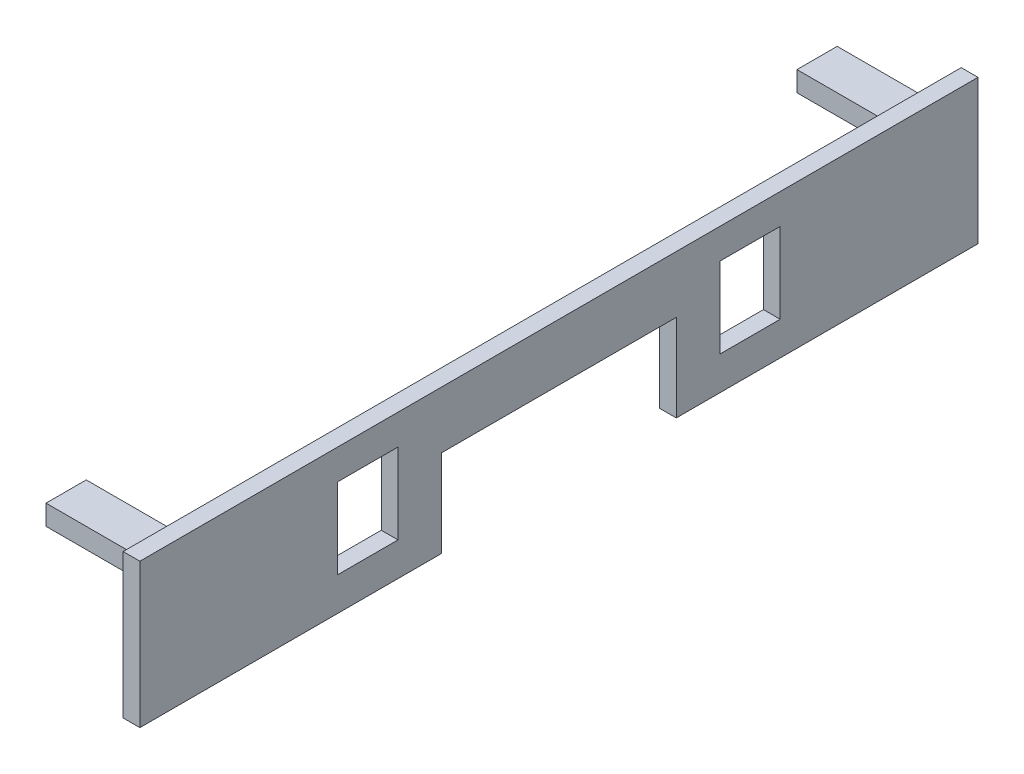
from build123d import *

# Parameters (mm, degrees)
SK_P01_BUMPERFACE_W      = 5
SK_P01_BUMPERFACE_H      = 13
P01_BUMPERFACE_DEPTH     = 43
SK_P02_BUMPERFACE_W      = 5
SK_P02_BUMPERFACE_H      = 59
P02_BUMPERFACE_DEPTH     = 43
SK_P03_BUMPERFACE_W      = 5
SK_P03_BUMPERFACE_H      = 18
P03_BUMPERFACE_DEPTH     = 10
P04_BUMPERFACE_START     = 34
SK_P04_BUMPERFACE_W      = 5
SK_P04_BUMPERFACE_H      = 18
P04_BUMPERFACE_DEPTH     = 9
P05_FLEXUREBRACKET_START = 31
SK_P05_FLEXUREBRACKET_W  = 30
SK_P05_FLEXUREBRACKET_H  = 12
P05_FLEXUREBRACKET_DEPTH = 6
P06_SWITCHSS5GL2_START   = 20
SK_P06_SWITCHSS5GL2_W    = 6.5
SK_P06_SWITCHSS5GL2_H    = 20
P06_SWITCHSS5GL2_DEPTH   = 10.2
SK_P07_BUMPERFACE_W      = 5
SK_P07_BUMPERFACE_H      = 13
P07_BUMPERFACE_DEPTH     = 43
SK_P08_BUMPERFACE_W      = 5
SK_P08_BUMPERFACE_H      = 59
P08_BUMPERFACE_DEPTH     = 43
SK_P09_BUMPERFACE_W      = 5
SK_P09_BUMPERFACE_H      = 18
P09_BUMPERFACE_DEPTH     = 10
P10_BUMPERFACE_START     = 34
SK_P10_BUMPERFACE_W      = 5
SK_P10_BUMPERFACE_H      = 18
P10_BUMPERFACE_DEPTH     = 9
P11_FLEXUREBRACKET_START = 31
SK_P11_FLEXUREBRACKET_W  = 30
SK_P11_FLEXUREBRACKET_H  = 12
P11_FLEXUREBRACKET_DEPTH = 6
P12_SWITCHSS5GL2_START   = 20
SK_P12_SWITCHSS5GL2_W    = 6.5
SK_P12_SWITCHSS5GL2_H    = 20
P12_SWITCHSS5GL2_DEPTH   = 10.2
P13_BUMPERFACE_START     = 26
SK_P13_BUMPERFACE_W      = 5
SK_P13_BUMPERFACE_H      = 70
P13_BUMPERFACE_DEPTH     = 17


with BuildPart() as part:
    # SK_P01_Bumperface → P01_Bumperface (new body)
    with BuildSketch(Plane(origin=(0, 0, 0), x_dir=(1, 0, 0), z_dir=(0, 1, 0))):
        with Locations((15, -41.5)):
            Rectangle(SK_P01_BUMPERFACE_W, SK_P01_BUMPERFACE_H)
    extrude(amount=P01_BUMPERFACE_DEPTH)



with BuildPart() as body_2:
    # SK_P02_Bumperface → P02_Bumperface (new body)
    with BuildSketch(Plane(origin=(0, 0, 0), x_dir=(1, 0, 0), z_dir=(0, 1, 0))):
        with Locations((15, -95.5)):
            Rectangle(SK_P02_BUMPERFACE_W, SK_P02_BUMPERFACE_H)
    extrude(amount=P02_BUMPERFACE_DEPTH)


with BuildPart() as part_1:
    add(part.part)

    add(body_2.part)  # P03_Bumperface merges body 2
    # SK_P03_Bumperface → P03_Bumperface (add)
    with BuildSketch(Plane(origin=(0, 0, 0), x_dir=(1, 0, 0), z_dir=(0, 1, 0))):
        with Locations((15, -57)):
            Rectangle(SK_P03_BUMPERFACE_W, SK_P03_BUMPERFACE_H)
    extrude(amount=P03_BUMPERFACE_DEPTH)

    # SK_P04_Bumperface → P04_Bumperface (add)
    with BuildSketch(Plane(origin=(0, 0, 0), x_dir=(1, 0, 0), z_dir=(0, 1, 0)).offset(P04_BUMPERFACE_START)):
        with Locations((15, -57)):
            Rectangle(SK_P04_BUMPERFACE_W, SK_P04_BUMPERFACE_H)
    extrude(amount=P04_BUMPERFACE_DEPTH)

    # SK_P05_Flexurebracket → P05_Flexurebracket (add)
    with BuildSketch(Plane(origin=(0, 0, 0), x_dir=(1, 0, 0), z_dir=(0, 1, 0)).offset(P05_FLEXUREBRACKET_START)):
        with Locations((-2.5, -112)):
            Rectangle(SK_P05_FLEXUREBRACKET_W, SK_P05_FLEXUREBRACKET_H)
    extrude(amount=P05_FLEXUREBRACKET_DEPTH)

    # SK_P06_SwitchSS5GL2 → P06_SwitchSS5GL2 (add)
    with BuildSketch(Plane(origin=(0, 0, 0), x_dir=(1, 0, 0), z_dir=(0, 1, 0)).offset(P06_SWITCHSS5GL2_START)):
        with Locations((9.25, -98)):
            Rectangle(SK_P06_SWITCHSS5GL2_W, SK_P06_SWITCHSS5GL2_H)
    extrude(amount=P06_SWITCHSS5GL2_DEPTH)



with BuildPart() as body_2_2:
    # SK_P07_Bumperface → P07_Bumperface (new body)
    with BuildSketch(Plane(origin=(0, 0, 0), x_dir=(1, 0, 0), z_dir=(0, 1, 0))):
        with Locations((15, 41.5)):
            Rectangle(SK_P07_BUMPERFACE_W, SK_P07_BUMPERFACE_H)
    extrude(amount=P07_BUMPERFACE_DEPTH)



with BuildPart() as body_3:
    # SK_P08_Bumperface → P08_Bumperface (new body)
    with BuildSketch(Plane(origin=(0, 0, 0), x_dir=(1, 0, 0), z_dir=(0, 1, 0))):
        with Locations((15, 95.5)):
            Rectangle(SK_P08_BUMPERFACE_W, SK_P08_BUMPERFACE_H)
    extrude(amount=P08_BUMPERFACE_DEPTH)


with BuildPart() as body_2_2_1:
    add(body_2_2.part)

    add(body_3.part)  # P09_Bumperface merges body 3
    # SK_P09_Bumperface → P09_Bumperface (add)
    with BuildSketch(Plane(origin=(0, 0, 0), x_dir=(1, 0, 0), z_dir=(0, 1, 0))):
        with Locations((15, 57)):
            Rectangle(SK_P09_BUMPERFACE_W, SK_P09_BUMPERFACE_H)
    extrude(amount=P09_BUMPERFACE_DEPTH)

    # SK_P10_Bumperface → P10_Bumperface (add)
    with BuildSketch(Plane(origin=(0, 0, 0), x_dir=(1, 0, 0), z_dir=(0, 1, 0)).offset(P10_BUMPERFACE_START)):
        with Locations((15, 57)):
            Rectangle(SK_P10_BUMPERFACE_W, SK_P10_BUMPERFACE_H)
    extrude(amount=P10_BUMPERFACE_DEPTH)

    # SK_P11_Flexurebracket → P11_Flexurebracket (add)
    with BuildSketch(Plane(origin=(0, 0, 0), x_dir=(1, 0, 0), z_dir=(0, 1, 0)).offset(P11_FLEXUREBRACKET_START)):
        with Locations((-2.5, 112)):
            Rectangle(SK_P11_FLEXUREBRACKET_W, SK_P11_FLEXUREBRACKET_H)
    extrude(amount=P11_FLEXUREBRACKET_DEPTH)

    # SK_P12_SwitchSS5GL2 → P12_SwitchSS5GL2 (add)
    with BuildSketch(Plane(origin=(0, 0, 0), x_dir=(1, 0, 0), z_dir=(0, 1, 0)).offset(P12_SWITCHSS5GL2_START)):
        with Locations((9.25, 98)):
            Rectangle(SK_P12_SWITCHSS5GL2_W, SK_P12_SWITCHSS5GL2_H)
    extrude(amount=P12_SWITCHSS5GL2_DEPTH)


with BuildPart() as part_2:
    add(part_1.part)

    add(body_2_2_1.part)  # P13_Bumperface merges body 2 2
    # SK_P13_Bumperface → P13_Bumperface (add)
    with BuildSketch(Plane(origin=(0, 0, 0), x_dir=(1, 0, 0), z_dir=(0, 1, 0)).offset(P13_BUMPERFACE_START)):
        with Locations((15, 0)):
            Rectangle(SK_P13_BUMPERFACE_W, SK_P13_BUMPERFACE_H)
    extrude(amount=P13_BUMPERFACE_DEPTH)


solid = part_2.part
